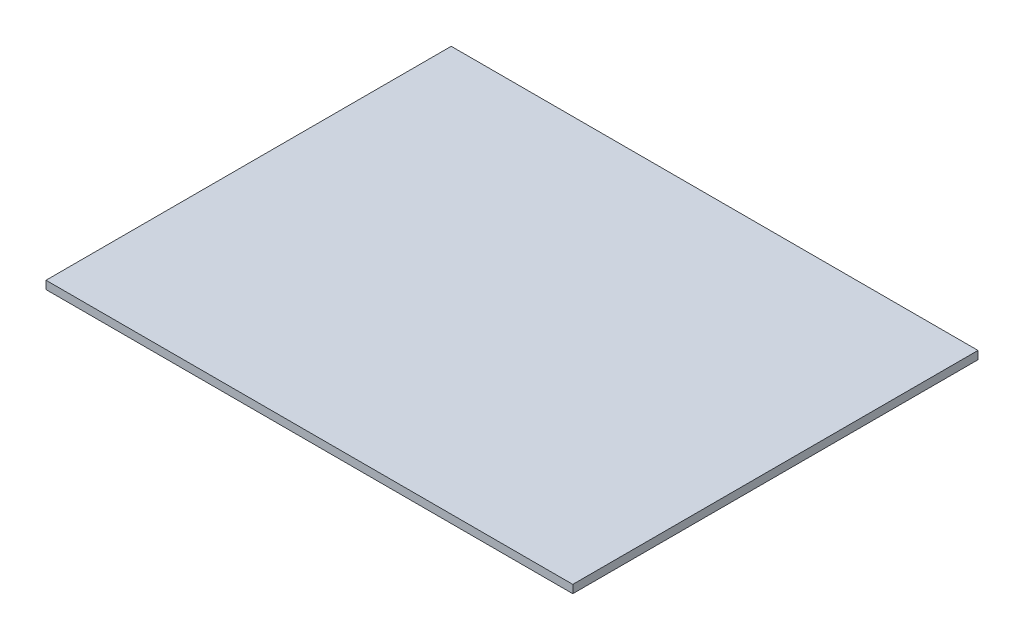
from build123d import *

# Parameters (mm, degrees)
SKETCH_1_W      = 650
SKETCH_1_H      = 500
EXTRUDE_1_DEPTH = 10


with BuildPart() as part:
    # Эскиз1 → Бобышка-Вытянуть1 (new body)
    with BuildSketch(Plane(origin=(0, 0, 0), x_dir=(1, 0, 0), z_dir=(0, 1, 0))):
        with Locations((325, 250)):
            Rectangle(SKETCH_1_W, SKETCH_1_H)
    extrude(amount=EXTRUDE_1_DEPTH)


solid = part.part
